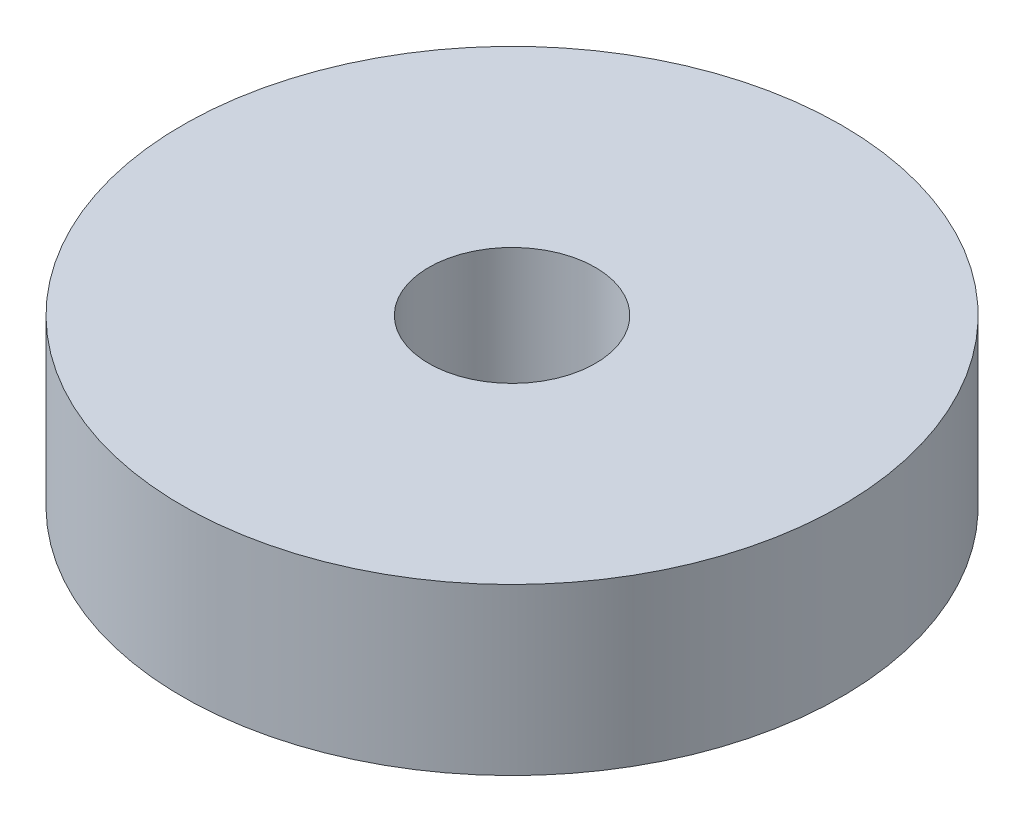
from build123d import *

# Parameters (mm, degrees)
GEAR_SKETCH_W = 8.93
GEAR_SKETCH_H = 6


with BuildPart() as part:
    # Gear Sketch → Gear (revolve)
    with BuildSketch(Plane.XY.offset(24)):
        with Locations((7.485, 61.5)):
            Rectangle(GEAR_SKETCH_W, GEAR_SKETCH_H)
    revolve(axis=Axis((0, -100, 24), (0, 1, 0)))


solid = part.part
